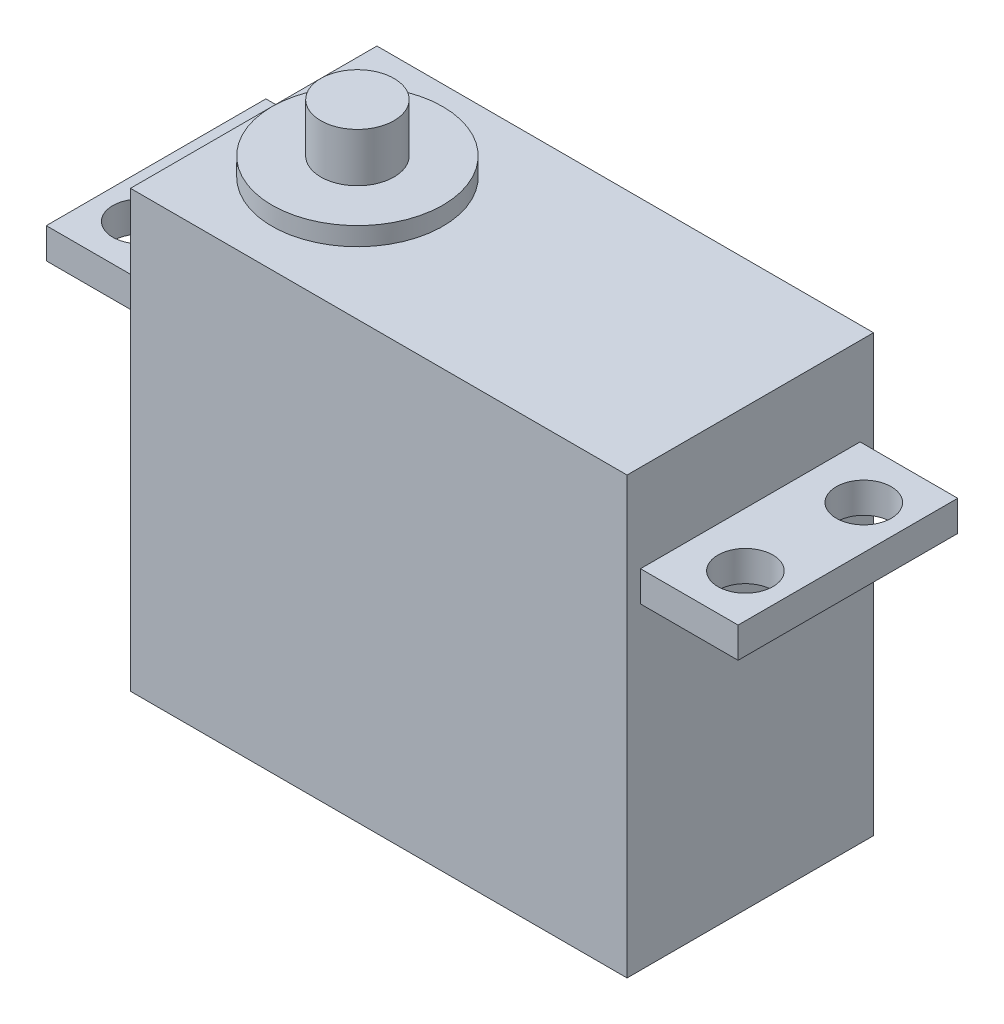
from build123d import *

# Parameters (mm, degrees)
SKIZZE1_W                            = 40.7
SKIZZE1_H                            = 35.7
AUFSATZ_LINEAR_AUSTRAGEN1_DEPTH      = 20.2
AUFSATZ_LINEAR_AUSTRAGEN2_DEPTH      = 8
AUFSATZ_LINEAR_AUSTRAGEN2_DEPTH_BACK = 48.7
SKIZZE2_W                            = 18
SKIZZE2_H                            = 2.5
SKIZZE3_R                            = 2.25
SCHNITT_LINEAR_AUSTRAGEN1_DEPTH      = 8
SKIZZE4_R                            = 7
AUFSATZ_LINEAR_AUSTRAGEN3_DEPTH      = 1.5
SKIZZE5_R                            = 3
AUFSATZ_LINEAR_AUSTRAGEN4_DEPTH      = 4
SKIZZE6_W                            = 6
SKIZZE6_H                            = 3.5
AUFSATZ_LINEAR_AUSTRAGEN5_DEPTH      = 4


with BuildPart() as part:
    # Skizze1 → Aufsatz-Linear austragen1 (new body)
    with BuildSketch(Plane.XY):
        with Locations((20.35, 17.85)):
            Rectangle(SKIZZE1_W, SKIZZE1_H)
    extrude(amount=AUFSATZ_LINEAR_AUSTRAGEN1_DEPTH)

    # Skizze2 → Aufsatz-Linear austragen2 (add, two sides: drawn at the far end of the back side and taken through both)
    with BuildSketch(Plane(origin=(40.7, 0, 0), x_dir=(0, 0, -1), z_dir=(1, 0, 0)).offset(-AUFSATZ_LINEAR_AUSTRAGEN2_DEPTH_BACK)):
        with Locations((-10.1, 27.25)):
            Rectangle(SKIZZE2_W, SKIZZE2_H)
    extrude(amount=AUFSATZ_LINEAR_AUSTRAGEN2_DEPTH + AUFSATZ_LINEAR_AUSTRAGEN2_DEPTH_BACK)

    # Skizze3 → Schnitt-Linear austragen1 (cut)
    with BuildSketch(Plane(origin=(0, 28.5, 0), x_dir=(1, 0, 0), z_dir=(0, 1, 0))):
        with Locations(Location((45.15, -5.25, 0), (0, 0, 180))):
            Circle(SKIZZE3_R)
        with Locations(Location((45.15, -14.95, 0), (0, 0, 180))):
            Circle(SKIZZE3_R)
        with Locations(Location((-4.45, -5.25, 0), (0, 0, 180))):
            Circle(SKIZZE3_R)
        with Locations(Location((-4.45, -14.95, 0), (0, 0, 180))):
            Circle(SKIZZE3_R)
    extrude(amount=-SCHNITT_LINEAR_AUSTRAGEN1_DEPTH, mode=Mode.SUBTRACT)

    # Skizze4 → Aufsatz-Linear austragen3 (add)
    with BuildSketch(Plane(origin=(0, 35.7, 0), x_dir=(1, 0, 0), z_dir=(0, 1, 0))):
        with Locations(Location((8.5, -10.1, 0), (0, 0, 90))):
            Circle(SKIZZE4_R)
    extrude(amount=AUFSATZ_LINEAR_AUSTRAGEN3_DEPTH)

    # Skizze5 → Aufsatz-Linear austragen4 (add)
    with BuildSketch(Plane(origin=(0, 37.2, 0), x_dir=(1, 0, 0), z_dir=(0, 1, 0))):
        with Locations(Location((8.5, -10.1, 0), (0, 0, 270))):
            Circle(SKIZZE5_R)
    extrude(amount=AUFSATZ_LINEAR_AUSTRAGEN4_DEPTH)

    # Skizze6 → Aufsatz-Linear austragen5 (add)
    with BuildSketch(Plane.ZY):
        with Locations((10.1, 2.75)):
            Rectangle(SKIZZE6_W, SKIZZE6_H)
    extrude(amount=AUFSATZ_LINEAR_AUSTRAGEN5_DEPTH)


solid = part.part
